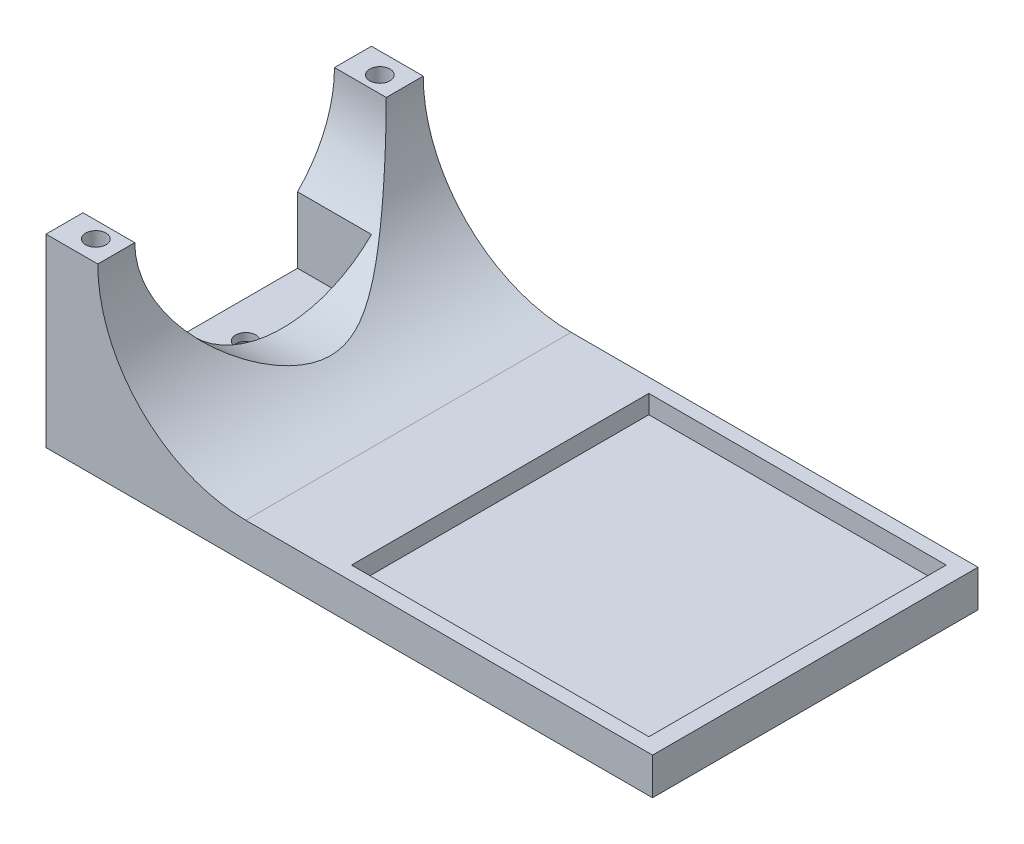
from build123d import *

# Parameters (mm, degrees)
SKETCH3_W           = 508
SKETCH3_H           = 111.76
BOSS_EXTRUDE1_DEPTH = 63.5
CUT_EXTRUDE1_START  = 6.35
SKETCH2_W           = 102.108
SKETCH2_H           = 102.108
CUT_EXTRUDE1_DEPTH  = 111.76
CUT_EXTRUDE2_DEPTH  = 156.718
SKETCH5_R           = 43.18
CUT_EXTRUDE3_DEPTH  = 355.6
SKETCH6_W           = 266.7
SKETCH6_H           = 101.6
CUT_EXTRUDE4_DEPTH  = 50.8
SKETCH8_OUTSIDE_W   = 614.802
SKETCH8_OUTSIDE_H   = 218.562
CUT_EXTRUDE5_DEPTH  = 174.244
SKETCH9_W           = 25.4
SKETCH9_H           = 60.96
BOSS_EXTRUDE2_DEPTH = 10.16
SKETCH10_R          = 3.5
CUT_EXTRUDE6_DEPTH  = 93.98
SKETCH10_3_R        = 5.5
CUT_EXTRUDE7_DEPTH  = 45.72
SKETCH12_R          = 3.5
CUT_EXTRUDE8_DEPTH  = 93.98
SKETCH12_3_R        = 5.5
CUT_EXTRUDE9_DEPTH  = 7.5


with BuildPart() as part:
    # Sketch3 → Boss-Extrude1 (new body)
    with BuildSketch(Plane(origin=(0, 0, 0), x_dir=(1, 0, 0), z_dir=(0, 1, 0))):
        with Locations((203.2, 36.195)):
            Rectangle(SKETCH3_W, SKETCH3_H)
    extrude(amount=BOSS_EXTRUDE1_DEPTH)

    # Sketch2 → Cut-Extrude1 (cut)
    with BuildSketch(Plane(origin=(0, 0, 0), x_dir=(1, 0, 0), z_dir=(0, 1, 0)).offset(CUT_EXTRUDE1_START)):
        with Locations((400.05, 36.195)):
            Rectangle(SKETCH2_W, SKETCH2_H)
    extrude(amount=CUT_EXTRUDE1_DEPTH, mode=Mode.SUBTRACT)

    # Sketch4 → Cut-Extrude2 (cut)
    with BuildSketch(Plane.XY.offset(19.685)):
        with BuildLine():
            Line((317.5, 12.7), (457.2, 12.7))
            Line((457.2, 12.7), (457.2, 63.5))
            Line((457.2, 63.5), (368.3, 63.5))
            ThreePointArc((368.3, 63.5), (281.578975516, 99.421024484), (317.5, 12.7))
        make_face()
    extrude(amount=-CUT_EXTRUDE2_DEPTH, mode=Mode.SUBTRACT)

    # Sketch5 → Cut-Extrude3 (cut)
    with BuildSketch(Plane(origin=(0, 0, 0), x_dir=(0, 0, -1), z_dir=(1, 0, 0))):
        with Locations((36.195, 63.5)):
            Circle(SKETCH5_R)
    extrude(amount=CUT_EXTRUDE3_DEPTH, mode=Mode.SUBTRACT)

    # Sketch6 → Cut-Extrude4 (cut)
    with BuildSketch(Plane(origin=(0, 63.5, 0), x_dir=(1, 0, 0), z_dir=(0, 1, 0))):
        with Locations((87.63, 36.195)):
            Rectangle(SKETCH6_W, SKETCH6_H)
    extrude(amount=-CUT_EXTRUDE4_DEPTH, mode=Mode.SUBTRACT)

    # Sketch7 → Cut-Revolve1 (revolve, cut)
    with BuildSketch(Plane(origin=(0, 63.5, 0), x_dir=(1, 0, 0), z_dir=(0, 1, 0))):
        with BuildLine():
            Line((233.68, -13.805), (237.541436971, -13.805))
            ThreePointArc((237.541436971, -13.805), (242.139619592, 11.007294884), (243.68, 36.195))
            Line((243.68, 36.195), (233.68, 36.195))
            Line((233.68, 36.195), (233.68, -13.805))
        make_face()
    revolve(axis=Axis((-45.72, 63.5, -36.195), (1, 0, 0)), mode=Mode.SUBTRACT)

    # Sketch8 outside → Cut-Extrude5 (cut)
    with BuildSketch(Plane.XZ):
        with Locations((203.2, -36.195)):
            Rectangle(SKETCH8_OUTSIDE_W, SKETCH8_OUTSIDE_H)
        Polygon((248.92, 19.685), (248.92, -5.715), (274.32, -5.715), (274.32, -66.675), (248.92, -66.675), (248.92, -92.075), (493.448726159, -149.556417416), (493.448726159, 67.99660497), align=None, mode=Mode.SUBTRACT)
    extrude(amount=-CUT_EXTRUDE5_DEPTH, mode=Mode.SUBTRACT)

    # Sketch9 → Boss-Extrude2 (add)
    with BuildSketch(Plane.XZ):
        with Locations((261.62, -36.195)):
            Rectangle(SKETCH9_W, SKETCH9_H)
    extrude(amount=-BOSS_EXTRUDE2_DEPTH)

    # Sketch10 → Cut-Extrude6 (cut)
    with BuildSketch(Plane.XZ):
        with Locations((258.9149, -84.963)):
            Circle(SKETCH10_R)
        with Locations((258.9149, 12.573)):
            Circle(SKETCH10_R)
    extrude(amount=-CUT_EXTRUDE6_DEPTH, mode=Mode.SUBTRACT)

    # Sketch10<3> → Cut-Extrude7 (cut)
    with BuildSketch(Plane.XZ):
        with Locations((258.9149, 12.573)):
            Circle(SKETCH10_3_R)
        with Locations((258.9149, -84.963)):
            Circle(SKETCH10_3_R)
    extrude(amount=-CUT_EXTRUDE7_DEPTH, mode=Mode.SUBTRACT)

    # Sketch12 → Cut-Extrude8 (cut)
    with BuildSketch(Plane.XZ):
        with Locations((261.62, -36.195)):
            Circle(SKETCH12_R)
    extrude(amount=-CUT_EXTRUDE8_DEPTH, mode=Mode.SUBTRACT)

    # Sketch12<3> → Cut-Extrude9 (cut)
    with BuildSketch(Plane.XZ):
        with Locations((261.62, -36.195)):
            Circle(SKETCH12_3_R)
    extrude(amount=-CUT_EXTRUDE9_DEPTH, mode=Mode.SUBTRACT)


solid = part.part
